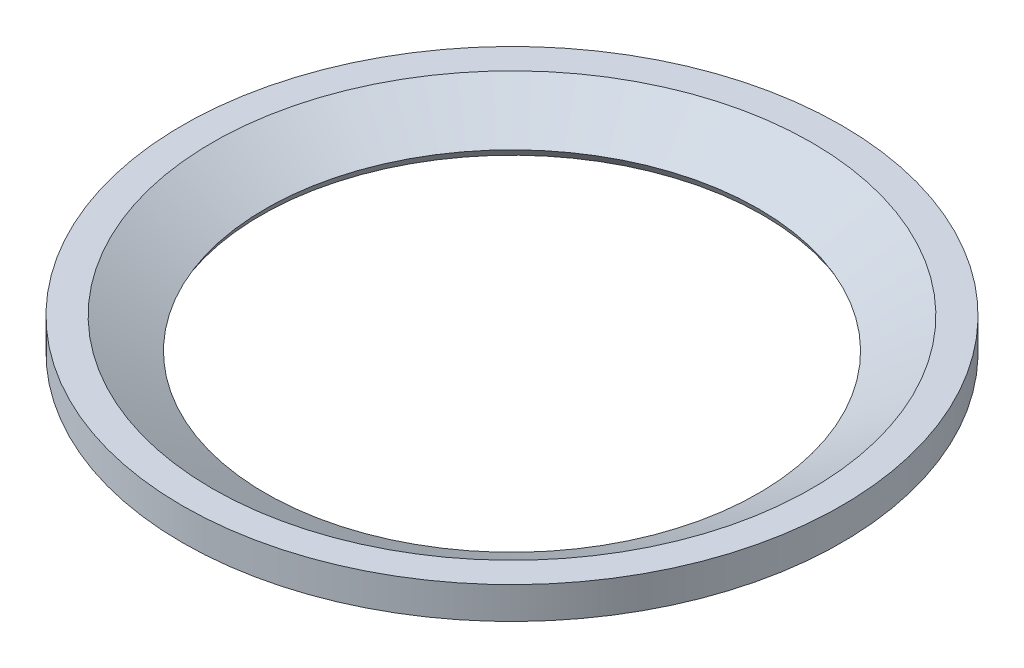
from build123d import *


with BuildPart() as part:
    # Sketch1 → Revolve-Thin1 (revolve)
    with BuildSketch(Plane.XY, mode=Mode.PRIVATE) as revolve_thin1_sk:
        Polygon((-34.925, -4.106115114), (-42.037, 0), (-44.577, 0), (-44.577, -3.175), (-45.847, -3.175), (-45.847, 1.27), (-41.696704526, 1.27), (-34.29, -3.006262852), align=None)
    revolve(revolve_thin1_sk.sketch.rotate(Axis((0, 0, 0), (0, 1, 0)), 270), axis=Axis((0, 0, 0), (0, 1, 0)))


solid = part.part
